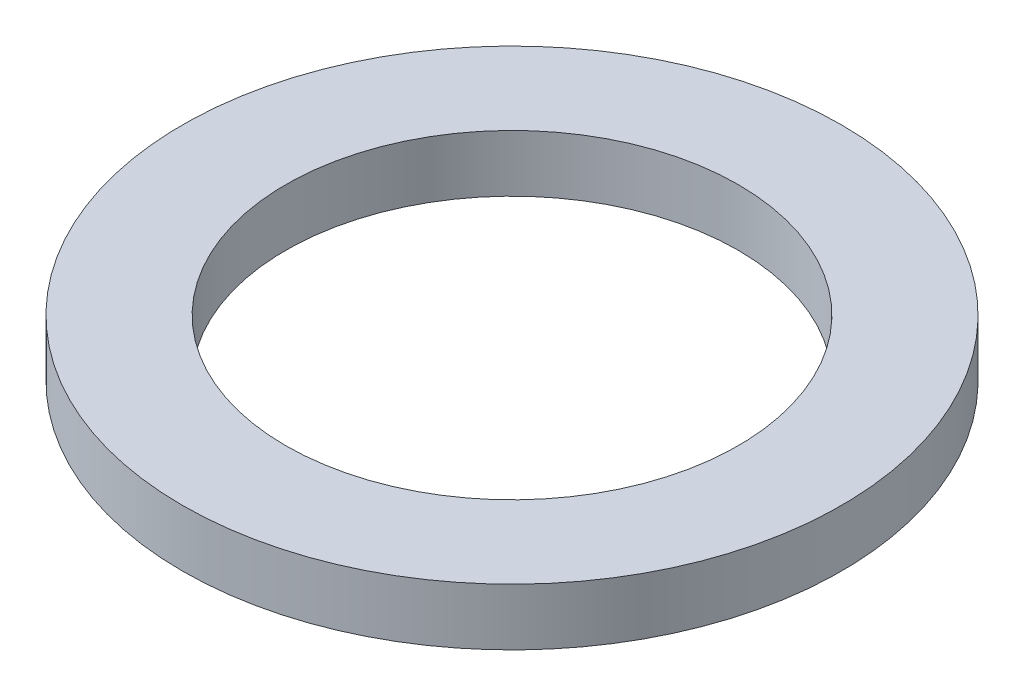
from build123d import *

# Parameters (mm, degrees)
SKETCH1_R           = 2.794
SKETCH1_R_2         = 1.9177
BOSS_EXTRUDE1_DEPTH = 0.4826


with BuildPart() as part:
    # Sketch1 → Boss-Extrude1 (new body)
    with BuildSketch(Plane(origin=(0, 0, 0), x_dir=(1, 0, 0), z_dir=(0, 1, 0))):
        with Locations(Location((0, 0, 0), (0, 0, 90))):
            Circle(SKETCH1_R)
        with Locations(Location((0, 0, 0), (0, 0, 90))):
            Circle(SKETCH1_R_2, mode=Mode.SUBTRACT)
    extrude(amount=BOSS_EXTRUDE1_DEPTH)


solid = part.part
